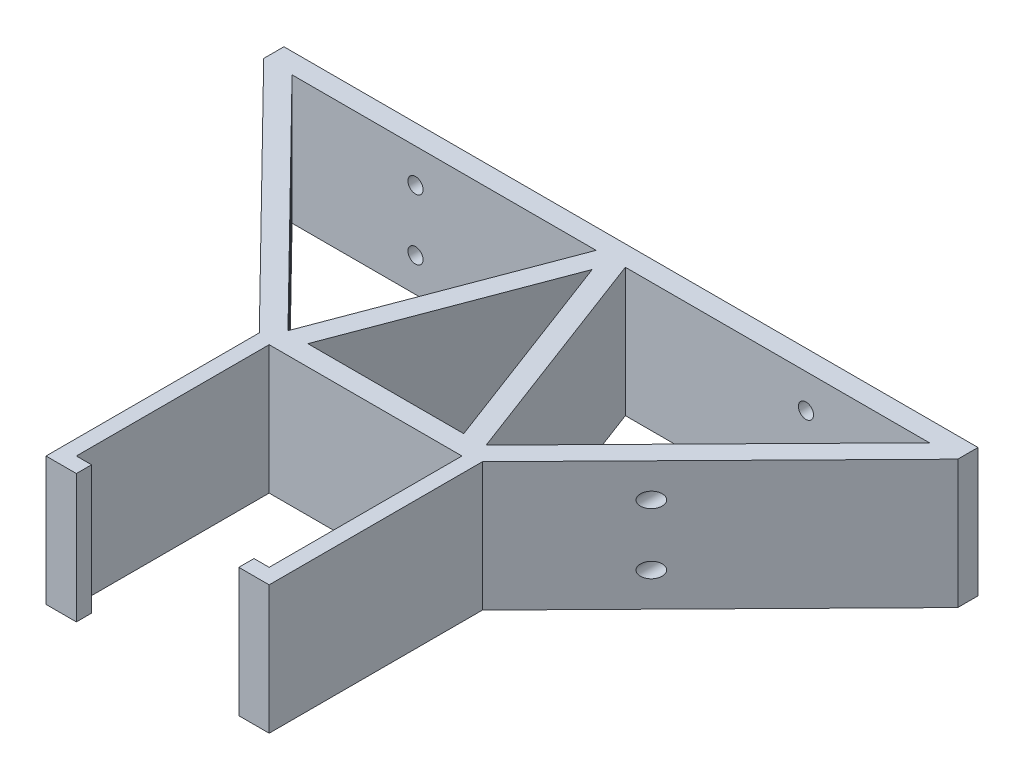
from build123d import *

# Parameters (mm, degrees)
BOSS_EXTRUDE1_DEPTH = 25.4
SKETCH2_R           = 1.5
CUT_EXTRUDE1_DEPTH  = 120.2689793


with BuildPart() as part:
    # Sketch1 → Boss-Extrude1 (new body)
    with BuildSketch(Plane(origin=(0, 0, 0), x_dir=(1, 0, 0), z_dir=(0, 1, 0))):
        Polygon((-21.143554781, 20.976139754), (-21.143554781, -21.178999859), (-15.143554781, -21.178999859), (-15.143554781, -18.178999859), (-18.143554781, -18.178999859), (-18.143554781, 19.921000141), (-19.143705232, 18.939106358), align=None)
        Polygon((16.956445219, -18.178999859), (16.956445219, -21.178999859), (22.956445219, -21.178999859), (22.956445219, 20.976139754), (20.956595671, 18.939106358), (19.956445219, 19.921000141), (19.956445219, -18.178999859), align=None)
        Polygon((-18.000706286, 20.061241092), (-18.143554781, 19.921000141), (-17.629307024, 19.921000141), align=None)
        Polygon((-21.143554781, 23.921000141), (-21.143554781, 20.976139754), (-19.143705232, 18.939106358), (-18.143554781, 19.921000141), (-18.000706286, 20.061241092), (-19.950434941, 20.797461723), (-18.770981881, 23.921000141), align=None)
        Polygon((-18.429197778, 23.921000141), (-18.770981881, 23.921000141), (-19.950434941, 20.797461723), (-18.000706286, 20.061241092), (-16.289346466, 21.741361883), align=None)
        Polygon((-14.495314995, 23.921000141), (-18.429197778, 23.921000141), (-16.289346466, 21.741361883), (-18.000706286, 20.061241092), (-17.629307024, 19.921000141), (-16.005721338, 19.921000141), align=None)
        Polygon((-18.676040592, 24.172432584), (-18.770981881, 23.921000141), (-18.429197778, 23.921000141), align=None)
        Polygon((-67.6732731, 68.371000141), (-21.143554781, 20.976139754), (-21.143554781, 23.921000141), (-18.770981881, 23.921000141), (-18.676040592, 24.172432584), (-62.06781096, 68.371000141), align=None)
        Polygon((-18.676040592, 24.172432584), (-18.429197778, 23.921000141), (-14.495314995, 23.921000141), (0.906445219, 64.70938874), (-0.476185052, 68.371000141), (-1.986591395, 68.371000141), align=None)
        Polygon((16.308205433, 23.921000141), (-14.495314995, 23.921000141), (-16.005721338, 19.921000141), (17.818611776, 19.921000141), align=None)
        Polygon((17.818611776, 19.921000141), (19.442197463, 19.921000141), (19.813596724, 20.061241092), (18.102236904, 21.741361883), (20.242088216, 23.921000141), (16.308205433, 23.921000141), align=None)
        Polygon((21.763325379, 20.797461723), (20.583872319, 23.921000141), (20.242088216, 23.921000141), (18.102236904, 21.741361883), (19.813596724, 20.061241092), align=None)
        Polygon((20.956595671, 18.939106358), (22.956445219, 20.976139754), (22.956445219, 23.921000141), (20.583872319, 23.921000141), (21.763325379, 20.797461723), (19.813596724, 20.061241092), (19.956445219, 19.921000141), align=None)
        Polygon((19.442197463, 19.921000141), (19.956445219, 19.921000141), (19.813596724, 20.061241092), align=None)
        Polygon((0.906445219, 64.70938874), (16.308205433, 23.921000141), (20.242088216, 23.921000141), (20.48893103, 24.172432584), (3.799481834, 68.371000141), (2.289075491, 68.371000141), align=None)
        Polygon((22.956445219, 23.921000141), (22.956445219, 20.976139754), (69.486163538, 68.371000141), (63.880701399, 68.371000141), (20.48893103, 24.172432584), (20.583872319, 23.921000141), align=None)
        Polygon((63.880701399, 68.371000141), (69.486163538, 68.371000141), (66.631804771, 71.173255667), align=None)
        Polygon((-67.6732731, 72.371000141), (-67.6732731, 68.371000141), (-64.818914333, 71.173255667), (-62.06781096, 68.371000141), (-1.986591395, 68.371000141), (-1.35741728, 70.037238153), (0.906445219, 69.182400084), (3.170307718, 70.037238153), (3.799481834, 68.371000141), (63.880701399, 68.371000141), (66.631804771, 71.173255667), (69.486163538, 68.371000141), (69.486163538, 72.371000141), align=None)
        Polygon((2.289075491, 68.371000141), (-0.476185052, 68.371000141), (0.906445219, 64.70938874), align=None)
        Polygon((-1.35741728, 70.037238153), (-1.986591395, 68.371000141), (-0.476185052, 68.371000141), (-0.571798584, 68.62421288), (0.906445219, 69.182400084), align=None)
        Polygon((-0.571798584, 68.62421288), (-0.476185052, 68.371000141), (2.289075491, 68.371000141), (2.384689022, 68.62421288), (0.906445219, 69.182400084), align=None)
        Polygon((2.384689022, 68.62421288), (2.289075491, 68.371000141), (3.799481834, 68.371000141), (3.170307718, 70.037238153), (0.906445219, 69.182400084), align=None)
        Polygon((-64.818914333, 71.173255667), (-67.6732731, 68.371000141), (-62.06781096, 68.371000141), align=None)
        Polygon((20.242088216, 23.921000141), (20.583872319, 23.921000141), (20.48893103, 24.172432584), align=None)
    extrude(amount=BOSS_EXTRUDE1_DEPTH)

    # Sketch2 → Cut-Extrude1 (cut, through all)
    with BuildSketch(Plane(origin=(0, 0, -72.371000141), x_dir=(-1, 0, 0), z_dir=(0, 0, -1))):
        with Locations((37.6732731, 6.7)):
            Circle(SKETCH2_R)
        with Locations((37.6732731, 18.7)):
            Circle(SKETCH2_R)
        with Locations((-39.486163538, 18.7)):
            Circle(SKETCH2_R)
        with Locations((-39.486163538, 6.7)):
            Circle(SKETCH2_R)
    extrude(amount=-CUT_EXTRUDE1_DEPTH, mode=Mode.SUBTRACT)


solid = part.part
